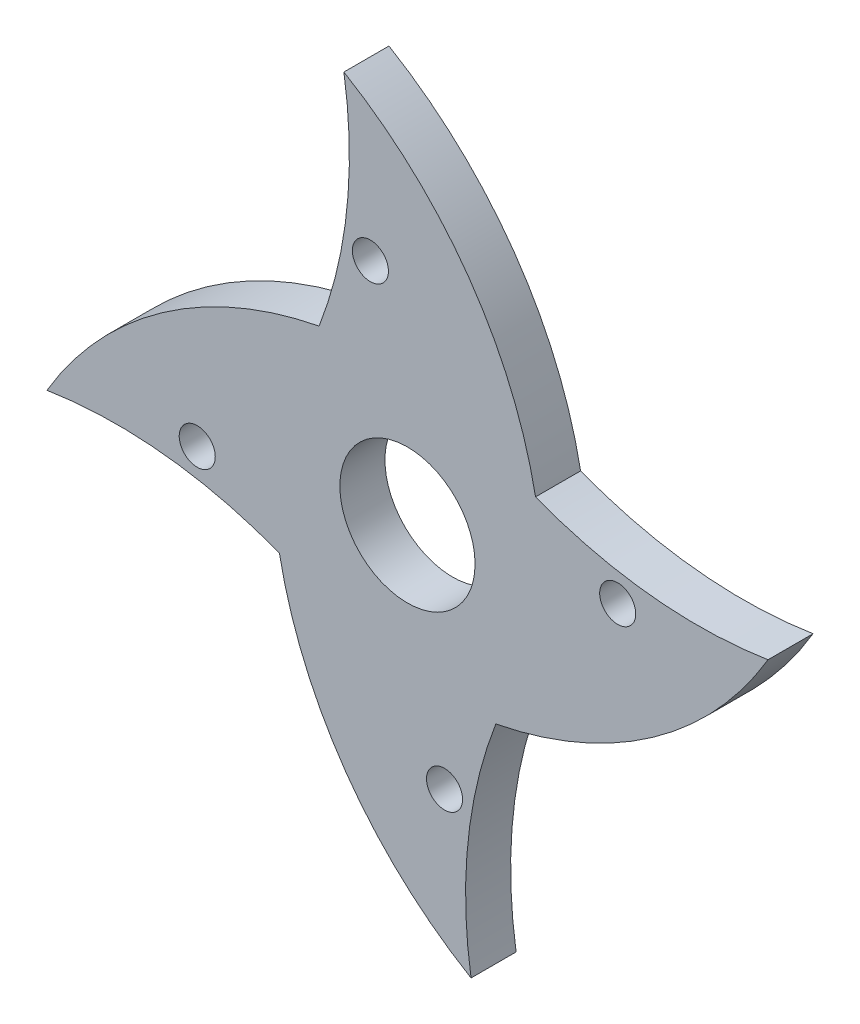
from build123d import *

# Parameters (mm, degrees)
CROQUIS1_R              = 4
CROQUIS1_R_2            = 30
CROQUIS1_R_3            = 15
SALIENTE_EXTRUIR2_DEPTH = 10


with BuildPart() as part:
    # Croquis1 → Saliente-Extruir2 (new body)
    # profile 1 of 2: a face of its own
    with BuildSketch(Plane.XY):
        with BuildLine():
            ThreePointArc((-80, -14.106158457), (-54.368470232, 13.637354869), (-19.61, 28.42))
            ThreePointArc((-19.61, 28.42), (-13.455358454, 53.846912835), (-14.106158457, 80))
            ThreePointArc((-14.106158457, 80), (13.637354869, 54.368470232), (28.42, 19.61))
            ThreePointArc((28.42, 19.61), (53.846912835, 13.455358454), (80, 14.106158457))
            ThreePointArc((80, 14.106158457), (54.368470232, -13.637354869), (19.61, -28.42))
            ThreePointArc((19.61, -28.42), (13.455358454, -53.846912835), (14.106158457, -80))
            ThreePointArc((14.106158457, -80), (-13.637354869, -54.368470232), (-28.42, -19.61))
            ThreePointArc((-28.42, -19.61), (-53.846912835, -13.455358454), (-80, -14.106158457))
        make_face()
        with Locations((-46.65, -8.22565365)):
            Circle(CROQUIS1_R, mode=Mode.SUBTRACT)
        Circle(CROQUIS1_R_2, mode=Mode.SUBTRACT)
        with Locations((-8.22565365, 46.65)):
            Circle(CROQUIS1_R, mode=Mode.SUBTRACT)
        with Locations((46.65, 8.22565365)):
            Circle(CROQUIS1_R, mode=Mode.SUBTRACT)
        with Locations((8.22565365, -46.65)):
            Circle(CROQUIS1_R, mode=Mode.SUBTRACT)
    # profile 2 of 2: a face of its own
    with BuildSketch(Plane.XY):
        Circle(CROQUIS1_R_2)
        Circle(CROQUIS1_R_3, mode=Mode.SUBTRACT)
    extrude(amount=SALIENTE_EXTRUIR2_DEPTH)


solid = part.part
